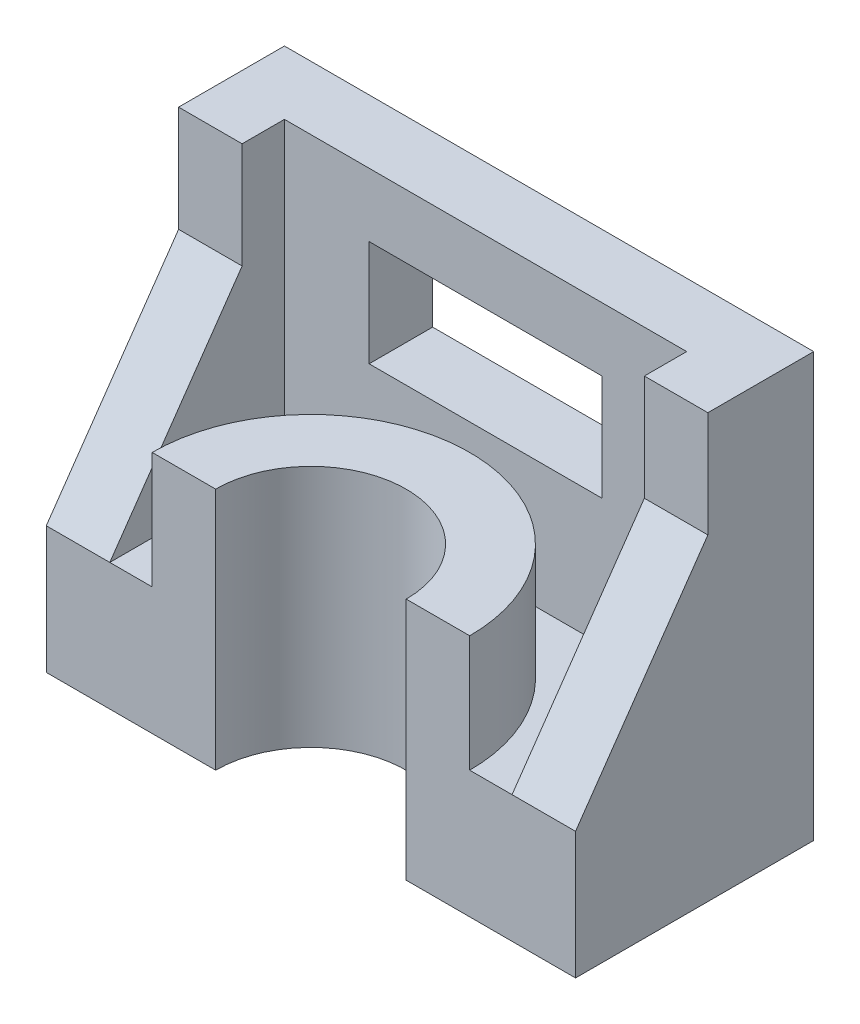
from build123d import *

# Parameters (mm, degrees)
BOSS_EXTRUDE1_DEPTH = 24
SKETCH1_4_W         = 12
SKETCH1_4_H         = 25
BOSS_EXTRUDE3_DEPTH = 60
BOSS_EXTRUDE5_DEPTH = 80
CUT_EXTRUDE4_DEPTH  = 104
BOSS_EXTRUDE6_DEPTH = 46
SKETCH5_W           = 44
SKETCH5_H           = 20
CUT_EXTRUDE5_DEPTH  = 46


with BuildPart() as part:
    # Sketch1 → Boss-Extrude1 (new body)
    with BuildSketch(Plane(origin=(0, 0, 0), x_dir=(1, 0, 0), z_dir=(0, 1, 0))):
        with BuildLine():
            Line((-50.214859888, 8.694484644), (-50.214859888, -16.305515356))
            Line((-50.214859888, -16.305515356), (-42.214859888, -16.305515356))
            ThreePointArc((-42.214859888, -16.305515356), (-12.214859888, 13.694484644), (17.785140112, -16.305515356))
            Line((17.785140112, -16.305515356), (25.785140112, -16.305515356))
            Line((25.785140112, -16.305515356), (25.785140112, 8.694484644))
            Line((25.785140112, 8.694484644), (25.785140112, 16.694484644))
            Line((25.785140112, 16.694484644), (-50.214859888, 16.694484644))
            Line((-50.214859888, 16.694484644), (-50.214859888, 8.694484644))
        make_face()
    extrude(amount=BOSS_EXTRUDE1_DEPTH)

    # Sketch1<4> → Boss-Extrude3 (add)
    with BuildSketch(Plane(origin=(0, 0, 0), x_dir=(1, 0, 0), z_dir=(0, 1, 0))):
        with Locations((-56.214859888, -3.805515356)):
            Rectangle(SKETCH1_4_W, SKETCH1_4_H)
        with Locations((31.785140112, -3.805515356)):
            Rectangle(SKETCH1_4_W, SKETCH1_4_H)
    extrude(amount=BOSS_EXTRUDE3_DEPTH)

    # Sketch1<7> → Boss-Extrude5 (add)
    with BuildSketch(Plane(origin=(0, 0, 0), x_dir=(1, 0, 0), z_dir=(0, 1, 0))):
        Polygon((-62.214859888, 28.694484644), (-62.214859888, 8.694484644), (-50.214859888, 8.694484644), (-50.214859888, 16.694484644), (25.785140112, 16.694484644), (25.785140112, 8.694484644), (37.785140112, 8.694484644), (37.785140112, 28.694484644), align=None)
    extrude(amount=BOSS_EXTRUDE5_DEPTH)

    # Sketch3 → Cut-Extrude4 (cut)
    with BuildSketch(Plane.ZY.offset(62.214859888)):
        Polygon((16.305515356, 24), (-8.694484644, 60), (16.305515356, 60), align=None)
    extrude(amount=-CUT_EXTRUDE4_DEPTH, mode=Mode.SUBTRACT)

    # Sketch1<8> → Boss-Extrude6 (add)
    with BuildSketch(Plane(origin=(0, 0, 0), x_dir=(1, 0, 0), z_dir=(0, 1, 0))):
        with BuildLine():
            ThreePointArc((17.785140112, -16.305515356), (-12.214859888, 13.694484644), (-42.214859888, -16.305515356))
            Line((-42.214859888, -16.305515356), (-30.214859888, -16.305515356))
            ThreePointArc((-30.214859888, -16.305515356), (-12.214859888, 1.694484644), (5.785140112, -16.305515356))
            Line((5.785140112, -16.305515356), (17.785140112, -16.305515356))
        make_face()
    extrude(amount=BOSS_EXTRUDE6_DEPTH)

    # Sketch5 → Cut-Extrude5 (cut)
    with BuildSketch(Plane.XY.offset(-16.694484644)):
        with Locations((-12.214859888, 58)):
            Rectangle(SKETCH5_W, SKETCH5_H)
    extrude(amount=-CUT_EXTRUDE5_DEPTH, mode=Mode.SUBTRACT)


solid = part.part
